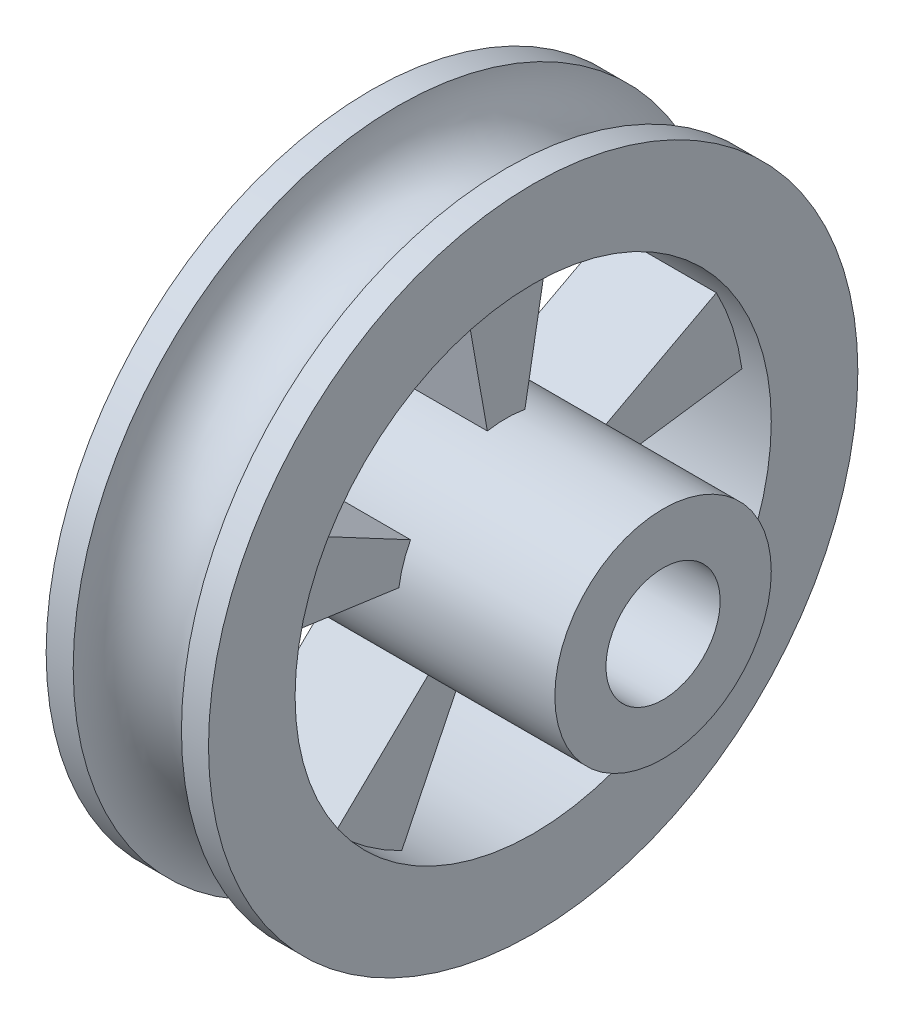
from build123d import *

# Parameters (mm, degrees)
SKETCH1_R           = 3.175
BOSS_EXTRUDE1_DEPTH = 3.81
BOSS_EXTRUDE2_START = 4.7625
SKETCH4_R           = 9.525
SKETCH4_R_2         = 6.985
SKETCH4_R_3         = 3.175
BOSS_EXTRUDE2_DEPTH = 4.7625
BOSS_EXTRUDE3_START = -0.79375
BOSS_EXTRUDE3_DEPTH = 3.175
CIRPATTERN1_COUNT   = 5
SKETCH6_R           = 1.5875
SKETCH7_R           = 1.675
CUT_EXTRUDE1_DEPTH  = 16.96680952


with BuildPart() as part:
    # Sketch1 → Boss-Extrude1 (new body)
    with BuildSketch(Plane(origin=(0, 0, 0), x_dir=(0, 0, -1), z_dir=(1, 0, 0))):
        with Locations(Location((0, 0, 0), (0, 0, 180))):
            Circle(SKETCH1_R)
    extrude(amount=BOSS_EXTRUDE1_DEPTH)

    # Sketch4 → Boss-Extrude2 (add)
    # profile 1 of 2: a face of its own
    with BuildSketch(Plane.ZY.offset(BOSS_EXTRUDE2_START)):
        with Locations(Location((0, 0, 0), (0, 0, 180))):
            Circle(SKETCH4_R)
        with Locations(Location((0, 0, 0), (0, 0, 180))):
            Circle(SKETCH4_R_2, mode=Mode.SUBTRACT)
    # profile 2 of 2: a face of its own
    with BuildSketch(Plane.ZY.offset(BOSS_EXTRUDE2_START)):
        Circle(SKETCH4_R_3)
    extrude(amount=-BOSS_EXTRUDE2_DEPTH)


with BuildPart() as boss_extrude2_piece_1:
    # of the separate pieces the step leaves, piece 1, a body of its own (boss_extrude2_pieces)
    add(part.part.solids().sort_by_distance((-4.7625, 0, -9.525))[0])



with BuildPart() as boss_extrude2_piece_2:
    # of the separate pieces the step leaves, piece 2, a body of its own (boss_extrude2_pieces)
    add(part.part.solids().sort_by_distance((3.81, 0, 3.175))[0])


with BuildPart() as boss_extrude2_piece_1_1:
    add(boss_extrude2_piece_1.part)

    add(boss_extrude2_piece_2.part)  # Boss-Extrude3 merges Boss-Extrude2 piece 2
    # Sketch5 → Boss-Extrude3 (add)
    with BuildSketch(Plane.ZY.offset(4.7625).offset(BOSS_EXTRUDE3_START)):
        with BuildLine():
            Line((0, 0), (1.212932521, 6.878882155))
            ThreePointArc((1.212932521, 6.878882155), (0, 6.985), (-1.212932521, 6.878882155))
            Line((-1.212932521, 6.878882155), (0, 0))
        make_face()
    boss_extrude3 = extrude(amount=-BOSS_EXTRUDE3_DEPTH)

    # CirPattern1: Boss-Extrude3 ×5 about axis
    cirpattern1_axis = Axis((0, 0, 0), (1, 0, 0))
    for i in range(1, CIRPATTERN1_COUNT):
        add(boss_extrude3.rotate(cirpattern1_axis, i * 360 / CIRPATTERN1_COUNT))

    # Sketch6 → Cut-Revolve1 (revolve, cut)
    with BuildSketch(Plane(origin=(0, 0, 0), x_dir=(1, 0, 0), z_dir=(0, 1, 0))):
        with Locations((-2.38125, 9.525)):
            Circle(SKETCH6_R)
    revolve(axis=Axis((3.81, 0, 0), (-1, 0, 0)), mode=Mode.SUBTRACT)

    # Sketch7 → Cut-Extrude1 (cut, through all)
    with BuildSketch(Plane.ZY.offset(4.7625)):
        Circle(SKETCH7_R)
    extrude(amount=-CUT_EXTRUDE1_DEPTH, mode=Mode.SUBTRACT)


solid = boss_extrude2_piece_1_1.part
